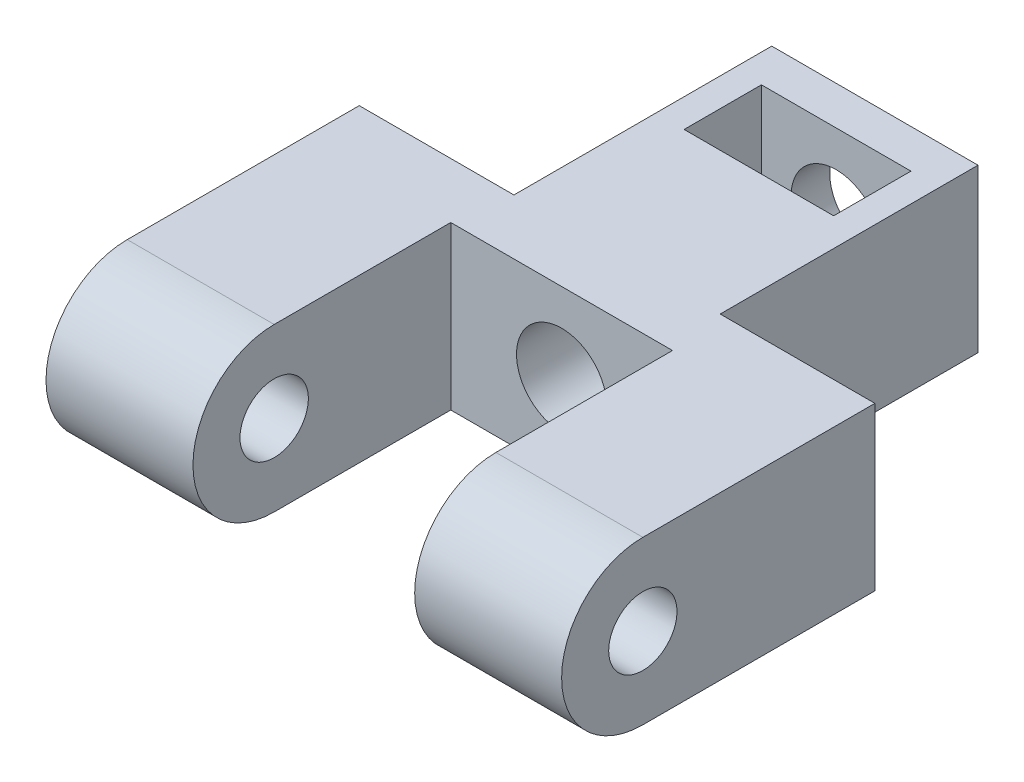
from build123d import *

# Parameters (mm, degrees)
SKETCH1_W           = 6.3
SKETCH1_H           = 8
SKETCH1_R           = 1.75
BOSS_EXTRUDE1_DEPTH = 10
SKETCH2_W           = 20
SKETCH2_H           = 6.3
SKETCH2_R           = 1.75
BOSS_EXTRUDE2_DEPTH = 12.15
SKETCH3_R           = 1.325
CUT_EXTRUDE1_DEPTH  = 31.009081959
SKETCH4_W           = 8.6
SKETCH4_H           = 6.3
CUT_EXTRUDE2_DEPTH  = 10
CUT_EXTRUDE3_DEPTH  = 31.009081959
SKETCH13_W          = 5.8
SKETCH13_H          = 3
CUT_EXTRUDE4_DEPTH  = 26.106025173


with BuildPart() as part:
    # Sketch1 → Boss-Extrude1 (new body)
    with BuildSketch(Plane(origin=(0, 0, 0), x_dir=(0, 1, 0), z_dir=(0, 0, 1))):
        Rectangle(SKETCH1_W, SKETCH1_H)
        with Locations(Location((0, 0, 0), (0, 0, 270))):
            Circle(SKETCH1_R, mode=Mode.SUBTRACT)
    extrude(amount=BOSS_EXTRUDE1_DEPTH)

    # Sketch2 → Boss-Extrude2 (add)
    with BuildSketch(Plane.XY.offset(10)):
        Rectangle(SKETCH2_W, SKETCH2_H)
        Circle(SKETCH2_R, mode=Mode.SUBTRACT)
    extrude(amount=BOSS_EXTRUDE2_DEPTH)

    # Sketch3 → Cut-Extrude1 (cut, through all)
    with BuildSketch(Plane(origin=(-10, 0, 0), x_dir=(0, -1, 0), z_dir=(-1, 0, 0))):
        with Locations(Location((0, 19, 0), (0, 0, 90))):
            Circle(SKETCH3_R)
    extrude(amount=-CUT_EXTRUDE1_DEPTH, mode=Mode.SUBTRACT)

    # Sketch4 → Cut-Extrude2 (cut)
    with BuildSketch(Plane.XY.offset(22.15)):
        Rectangle(SKETCH4_W, SKETCH4_H)
    extrude(amount=-CUT_EXTRUDE2_DEPTH, mode=Mode.SUBTRACT)

    # Sketch11 → Cut-Extrude3 (cut, through all)
    with BuildSketch(Plane(origin=(-10, 0, 0), x_dir=(0, -1, 0), z_dir=(-1, 0, 0))):
        with BuildLine():
            Line((-3.15, 19), (-3.15, 24.112369899))
            Line((-3.15, 24.112369899), (3.15, 24.112369899))
            Line((3.15, 24.112369899), (3.15, 19))
            ThreePointArc((3.15, 19), (0, 22.15), (-3.15, 19))
        make_face()
    extrude(amount=-CUT_EXTRUDE3_DEPTH, mode=Mode.SUBTRACT)

    # Sketch13 → Cut-Extrude4 (cut, through all)
    with BuildSketch(Plane(origin=(0, 3.15, 0), x_dir=(-1, 0, 0), z_dir=(0, 1, 0))):
        with Locations((0, 3)):
            Rectangle(SKETCH13_W, SKETCH13_H)
    extrude(amount=-CUT_EXTRUDE4_DEPTH, mode=Mode.SUBTRACT)


solid = part.part
